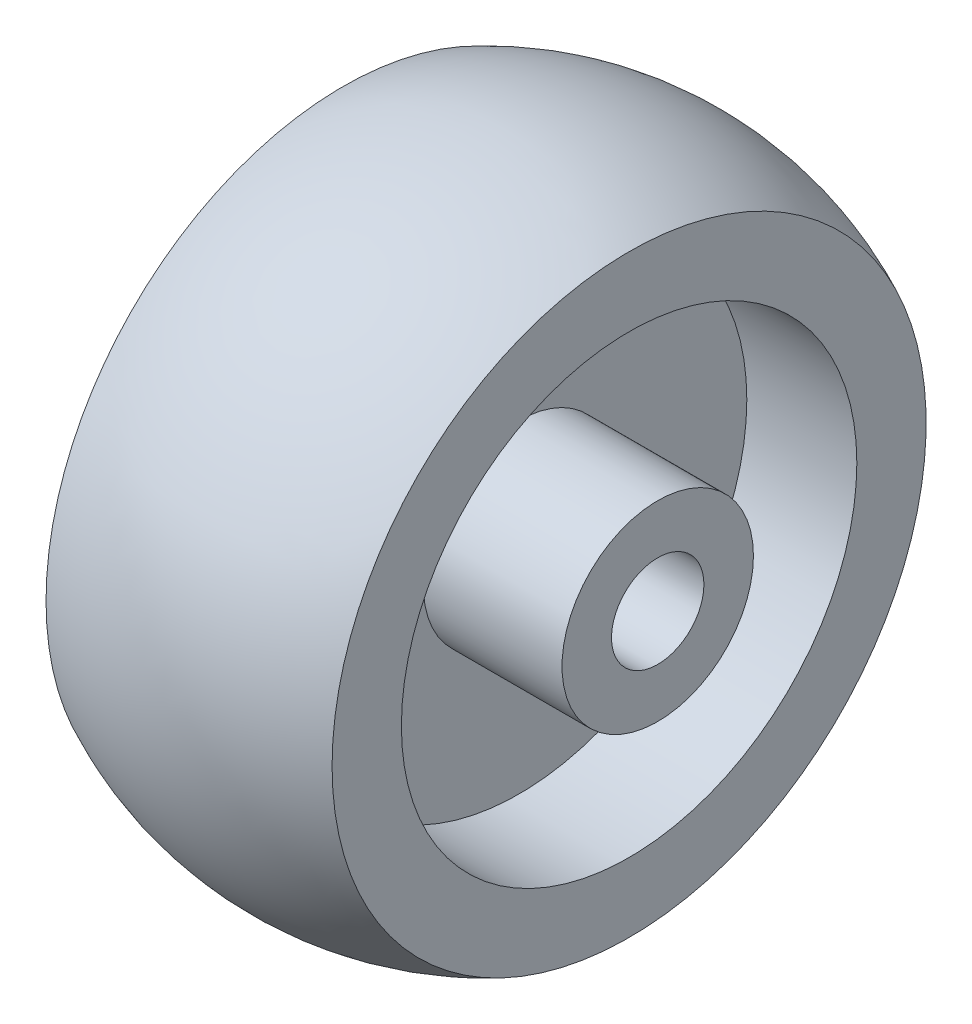
from build123d import *

# Parameters (mm, degrees)
SKETCH6_R           = 10.35
CUT_EXTRUDE1_DEPTH  = 5
SKETCH7_R           = 4.35
SKETCH7_R_2         = 2.1
BOSS_EXTRUDE3_DEPTH = 6.3


with BuildPart() as part:
    # Sketch5 → Revolve1 (revolve)
    with BuildSketch(Plane.XY, mode=Mode.PRIVATE) as revolve1_sk:
        with BuildLine():
            Line((6.5, 0), (6.5, 13.5))
            ThreePointArc((6.5, 13.5), (0, 14.981494165), (-6.5, 13.5))
            Line((-6.5, 13.5), (-6.5, 0))
            Line((-6.5, 0), (6.5, 0))
        make_face()
    revolve(revolve1_sk.sketch.rotate(Axis((-6.5, 0, 0), (1, 0, 0)), 90), axis=Axis((-6.5, 0, 0), (1, 0, 0)))

    # Sketch6 → Cut-Extrude1 (cut)
    with BuildSketch(Plane(origin=(6.5, 0, 0), x_dir=(0, 0, -1), z_dir=(1, 0, 0))):
        Circle(SKETCH6_R)
    cut_extrude1 = extrude(amount=-CUT_EXTRUDE1_DEPTH, mode=Mode.SUBTRACT)

    # Sketch7 → Boss-Extrude3 (add)
    with BuildSketch(Plane(origin=(1.5, 0, 0), x_dir=(0, 0, -1), z_dir=(1, 0, 0))):
        Circle(SKETCH7_R)
        Circle(SKETCH7_R_2, mode=Mode.SUBTRACT)
    boss_extrude3 = extrude(amount=BOSS_EXTRUDE3_DEPTH)

    # Mirror2: Cut-Extrude1, Boss-Extrude3 across plane
    add(cut_extrude1.mirror(Plane(origin=(0, 0, 0), x_dir=(0, 0, 1), z_dir=(1, 0, 0))), mode=Mode.SUBTRACT)
    add(boss_extrude3.mirror(Plane(origin=(0, 0, 0), x_dir=(0, 0, 1), z_dir=(1, 0, 0))))


solid = part.part
